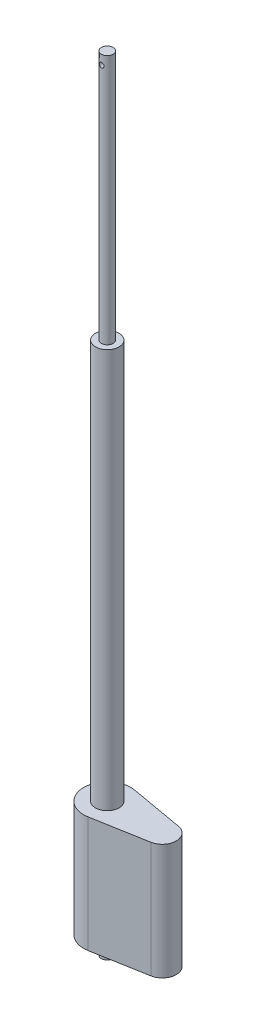
from build123d import *

# Parameters (mm, degrees)
CUT_EXTRUDE2_DEPTH      = 656.610402602
CUT_EXTRUDE2_DEPTH_BACK = 656.610402602
SKETCH8_R               = 2
BOSS_EXTRUDE4_DEPTH     = 98


with BuildPart() as part:
    # Sketch7 → Revolve2 (revolve)
    with BuildSketch(Plane(origin=(0, 0, 0), x_dir=(0, 0, -1), z_dir=(1, 0, 0))):
        Polygon((-20, 7), (-20, 105), (-10, 105), (-10, 443), (-5, 443), (-5, 655), (0, 655), (0, -8), (-5, -8), (-5, 7), align=None)
    revolve(axis=Axis((0, 655, 0), (0, -1, 0)))

    # Sketch8 → Cut-Extrude2 (cut, two sides: drawn at the far end of the back side and taken through both)
    with BuildSketch(Plane.XY.offset(-CUT_EXTRUDE2_DEPTH_BACK)):
        with Locations((0, 647)):
            Circle(SKETCH8_R)
        Circle(SKETCH8_R)
    extrude(amount=CUT_EXTRUDE2_DEPTH + CUT_EXTRUDE2_DEPTH_BACK, mode=Mode.SUBTRACT)

    # Sketch10 → Boss-Extrude4 (add)
    with BuildSketch(Plane(origin=(0, 105, 0), x_dir=(1, 0, 0), z_dir=(0, 1, 0))):
        with BuildLine():
            Line((3.491027189, 19.692961412), (48.629242089, 11.691181882))
            ThreePointArc((48.629242089, 11.691181882), (58.430175518, 0), (48.629242089, -11.691181882))
            Line((48.629242089, -11.691181882), (3.491027189, -19.692961412))
            ThreePointArc((3.491027189, -19.692961412), (-20, 0), (3.491027189, 19.692961412))
        make_face()
    extrude(amount=-BOSS_EXTRUDE4_DEPTH)


solid = part.part
